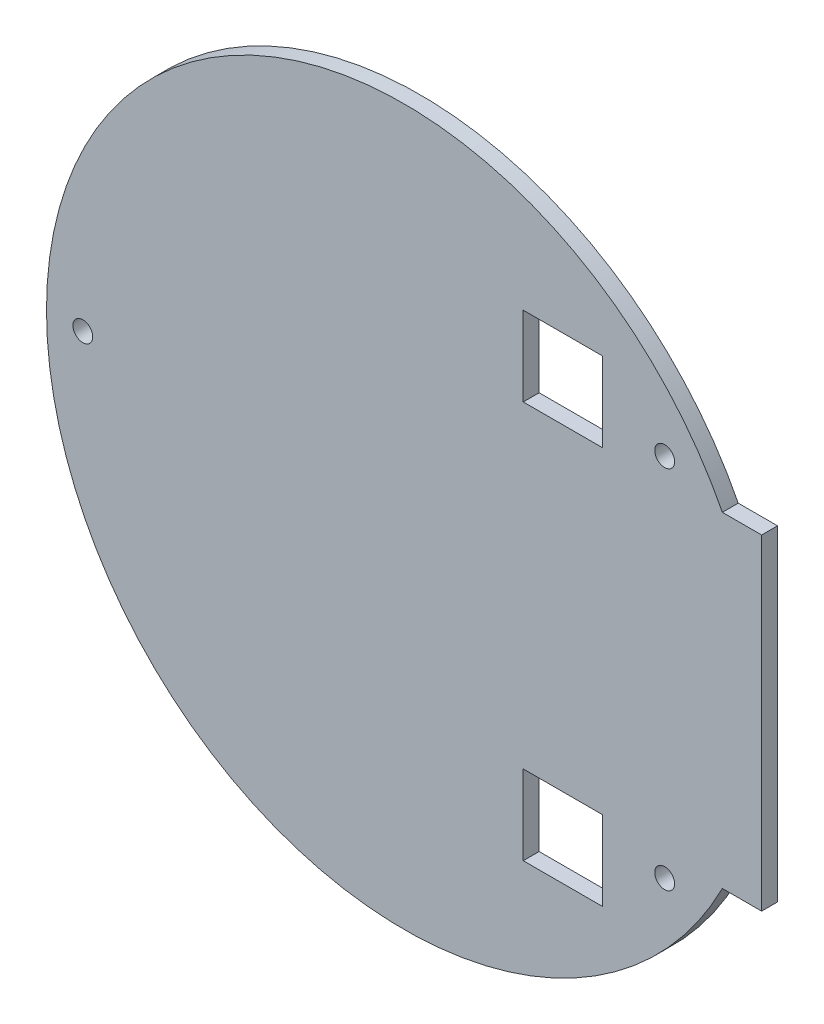
from build123d import *

# Parameters (mm, degrees)
SKETCH1_R  = 1.25
SKETCH1_W  = 10
SKETCH1_H  = 10
BODY_DEPTH = 2


with BuildPart() as part:
    # Sketch1 → Body (new body)
    with BuildSketch(Plane.XY):
        with BuildLine():
            Line((45, 20.5), (40.059330998, 20.5))
            ThreePointArc((40.059330998, 20.5), (-45, 0), (40.059330998, -20.5))
            Line((40.059330998, -20.5), (45, -20.5))
            Line((45, -20.5), (45, 20.5))
        make_face()
        with Locations((-40.427264064, 0)):
            Circle(SKETCH1_R, mode=Mode.SUBTRACT)
        with Locations((32.798809505, -23)):
            Circle(SKETCH1_R, mode=Mode.SUBTRACT)
        with Locations((32.798809505, 23)):
            Circle(SKETCH1_R, mode=Mode.SUBTRACT)
        with Locations((20, 25)):
            Rectangle(SKETCH1_W, SKETCH1_H, mode=Mode.SUBTRACT)
        with Locations((20, -25)):
            Rectangle(SKETCH1_W, SKETCH1_H, mode=Mode.SUBTRACT)
    extrude(amount=BODY_DEPTH)


solid = part.part
